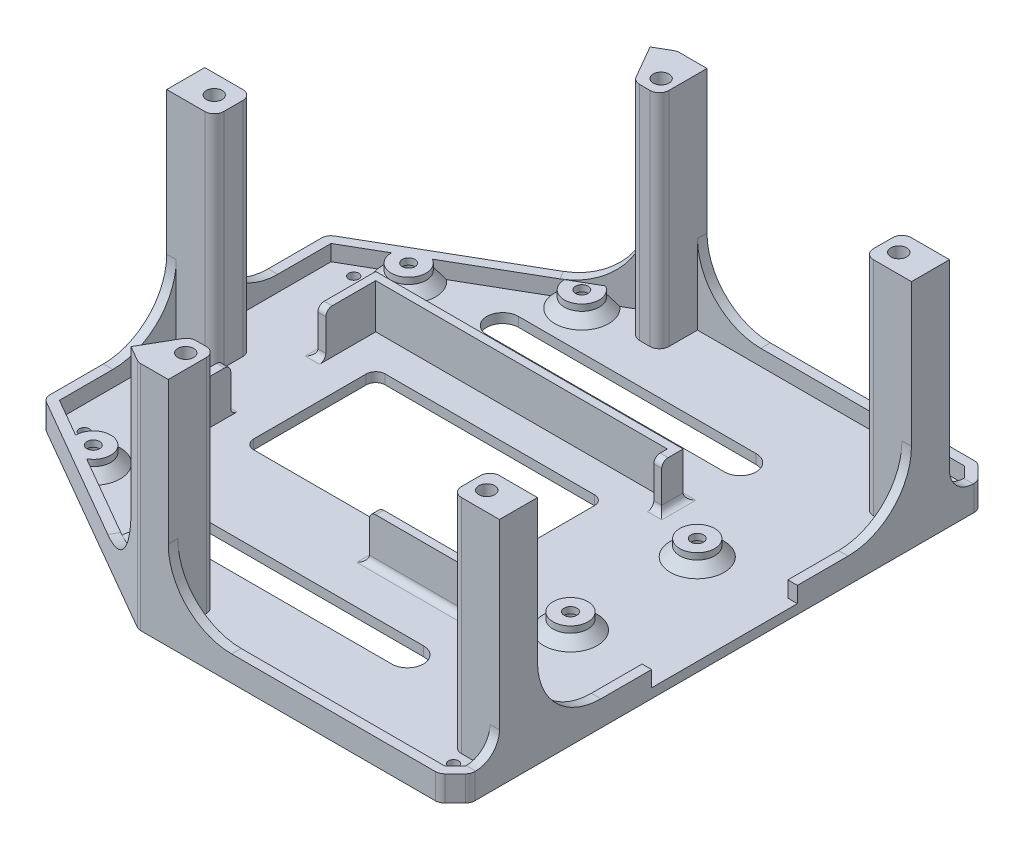
from build123d import *

# Parameters (mm, degrees)
BOSS_EXTRUDE1_DEPTH = 3
CHAMFER1_SIZE       = 5
FILLET1_R           = 3
BOSS_EXTRUDE2_START = 5
BOSS_EXTRUDE2_DEPTH = 5
BOSS_EXTRUDE5_START = 70
SKETCH9_W           = 3
SKETCH9_H           = 12.000000000000007
BOSS_EXTRUDE5_DEPTH = 70
FILLET2_R           = 20
FILLET4_R           = 7.5
SKETCH10_R          = 1.600000000000006
SKETCH10_R_2        = 1.5999999999999994
CUT_EXTRUDE1_DEPTH  = 10
SKETCH11_R          = 2.4999999999999956
SKETCH11_R_2        = 2.5000000000000027
CUT_EXTRUDE2_DEPTH  = 20
SKETCH12_R          = 5.499999999999991
SKETCH12_R_2        = 2.4999999999999956
SKETCH12_R_3        = 5.500000000000005
SKETCH12_R_4        = 2.5000000000000027
BOSS_EXTRUDE6_DEPTH = 3
SKETCH13_R          = 5.5000000000000036
SKETCH13_R_2        = 1.9999999999999991
SKETCH13_R_3        = 1.9999999999999967
BOSS_EXTRUDE7_DEPTH = 2
CHAMFER2_SIZE       = 3
SKETCH14_R          = 2.500000000000009
SKETCH14_R_2        = 2.4999999999999956
SKETCH14_R_3        = 2.5000000000000027
CUT_EXTRUDE3_DEPTH  = 6
SKETCH15_R          = 1.9999999999999967
SKETCH15_R_2        = 2.0000000000000036
CUT_EXTRUDE4_DEPTH  = 20
BOSS_EXTRUDE8_DEPTH = 14
FILLET5_R           = 2
CUT_EXTRUDE5_DEPTH  = 15
CUT_EXTRUDE6_DEPTH  = 15
CUT_EXTRUDE7_DEPTH  = 20


with BuildPart() as part:
    # Sketch1 → Boss-Extrude1 (new body)
    with BuildSketch(Plane(origin=(0, 0, 0), x_dir=(1, 0, 0), z_dir=(0, 1, 0))):
        Polygon((-50, 85), (-120.00000000000003, 44.58548115672608), (-120.00000000000003, -44.58548115672608), (-50, -85), (49.999999999999986, -85), (50, 85), align=None)
    extrude(amount=BOSS_EXTRUDE1_DEPTH)

    # Chamfer1
    chamfer1_edges = [part.edges().sort_by_distance(p)[0] for p in [
        (49.999999999999986, 1.5, 85),
        (50, 1.5, -85),
    ]]
    chamfer(chamfer1_edges, length=CHAMFER1_SIZE)

    # Fillet1
    fillet1_edges = [part.edges().sort_by_distance(p)[0] for p in [
        (-50, 1.5, 85),
        (-120.00000000000003, 1.5, 44.58548115672608),
        (-120.00000000000003, 1.5, -44.58548115672608),
        (-50, 1.5, -85),
        (50, 1.5, -80),
        (49.999999999999986, 1.5, 80),
        (44.999999999999986, 1.5, 85),
        (45, 1.5, -85),
    ]]
    fillet(fillet1_edges, radius=FILLET1_R)

    # Sketch3 → Boss-Extrude2 (add)
    with BuildSketch(Plane(origin=(0, 3, 0), x_dir=(1, 0, 0), z_dir=(0, 1, 0)).offset(BOSS_EXTRUDE2_START)):
        with BuildLine():
            Line((49.999999999999986, -78.7573593128807), (50, 78.75735931288068))
            ThreePointArc((50, 78.75735931288068), (49.77163859753386, 79.90540960997595), (49.121320343559645, 80.87867965644033))
            Line((49.121320343559645, 80.87867965644033), (45.87867965644036, 84.12132034355965))
            ThreePointArc((45.87867965644036, 84.12132034355965), (44.90540960997598, 84.77163859753387), (43.7573593128807, 85))
            Line((43.7573593128807, 85), (-49.19615242270664, 85))
            ThreePointArc((-49.19615242270664, 85), (-49.9726095580142, 84.8977774788672), (-50.69615242270664, 84.59807621135332))
            Line((-50.69615242270664, 84.59807621135332), (-118.50000000000003, 45.45150656051051))
            ThreePointArc((-118.50000000000003, 45.45150656051051), (-119.59807621135333, 44.35343034915719), (-120.00000000000003, 42.8534303491572))
            Line((-120.00000000000003, 42.8534303491572), (-120.00000000000003, -42.85343034915721))
            ThreePointArc((-120.00000000000003, -42.85343034915721), (-119.59807621135334, -44.35343034915721), (-118.50000000000003, -45.45150656051052))
            Line((-118.50000000000003, -45.45150656051052), (-50.69615242270665, -84.59807621135332))
            ThreePointArc((-50.69615242270665, -84.59807621135332), (-49.97260955801421, -84.8977774788672), (-49.19615242270665, -85))
            Line((-49.19615242270665, -85), (43.75735931288061, -85))
            ThreePointArc((43.75735931288061, -85), (44.905409609975884, -84.77163859753387), (45.87867965644027, -84.12132034355966))
            Line((45.87867965644027, -84.12132034355966), (49.121320343559624, -80.87867965644034))
            ThreePointArc((49.121320343559624, -80.87867965644034), (49.771638597533844, -79.90540960997596), (49.999999999999986, -78.7573593128807))
        make_face()
        Polygon((-117.00000000000001, 42.8534303491572), (-117, -42.853430349157215), (-49.19615242270665, -82), (43.75735931288061, -82), (46.999999999999986, -78.7573593128807), (46.999999999999986, 78.7573593128807), (43.75735931288071, 81.99999999999997), (-49.19615242270664, 81.99999999999999), align=None, mode=Mode.SUBTRACT)
    extrude(amount=-BOSS_EXTRUDE2_DEPTH)

    # Sketch9 → Boss-Extrude5 (add)
    with BuildSketch(Plane(origin=(0, 3, 0), x_dir=(1, 0, 0), z_dir=(0, 1, 0)).offset(BOSS_EXTRUDE5_START)):
        with BuildLine():
            Line((-108.00000000000003, 6), (-117.00000000000001, 5.999999999999999))
            Line((-117.00000000000001, 6), (-117.00000000000001, 0))
            Line((-117.00000000000001, 0), (-105.00000000000003, 0))
            Line((-105.00000000000003, 0), (-105.00000000000003, 3.0000000000000004))
            ThreePointArc((-105.00000000000003, 3.0000000000000004), (-105.87867965644038, 5.121320343559644), (-108.00000000000003, 5.999999999999995))
        make_face()
        with BuildLine():
            Line((-105.00000000000003, 0), (-117.00000000000001, 0))
            Line((-117.00000000000001, 0), (-117, -6))
            Line((-117, -5.999999999999999), (-108.00000000000003, -6))
            ThreePointArc((-108.00000000000003, -5.999999999999995), (-105.87867965644038, -5.121320343559644), (-105.00000000000003, -3.0000000000000004))
            Line((-105.00000000000003, -3.0000000000000004), (-105.00000000000003, 0))
        make_face()
        with BuildLine():
            Line((-49.38268590217983, -71.50000000000001), (-53.882685902179844, -79.29422863405998))
            Line((-53.882685902179816, -79.29422863405998), (-49.19615242270666, -82))
            Line((-49.19615242270665, -82), (-40.51666049839536, -82))
            Line((-40.51666049839536, -82), (-40.51666049839537, -73.00000000000001))
            ThreePointArc((-40.51666049839536, -73.00000000000001), (-41.39534015483572, -70.87867965644037), (-43.51666049839537, -70))
            Line((-43.51666049839537, -70), (-46.784609690826514, -69.99999999999999))
            ThreePointArc((-46.784609690826514, -69.99999999999999), (-48.284609690826514, -70.4019237886467), (-49.38268590217983, -71.50000000000001))
        make_face()
        with BuildLine():
            Line((-49.19615242270666, -82), (-53.882685902179816, -79.29422863405998))
            Line((-53.882685902179844, -79.29422863405998), (-55.38268590217983, -81.89230484541326))
            Line((-55.38268590217983, -81.89230484541326), (-50.69615242270666, -84.59807621135332))
            ThreePointArc((-50.69615242270666, -84.59807621135332), (-49.972609558014206, -84.8977774788672), (-49.19615242270663, -85))
            Line((-49.19615242270663, -85), (-40.51666049839536, -85))
            Line((-40.51666049839536, -85), (-40.51666049839536, -82))
            Line((-40.51666049839536, -82), (-49.19615242270665, -82))
        make_face()
        with BuildLine():
            Line((46.999999999999986, -71.00000000000001), (46.999999999999986, -59.000000000000014))
            Line((46.999999999999986, -59.00000000000001), (37.99999999999999, -59.000000000000014))
            ThreePointArc((37.99999999999999, -59.000000000000014), (35.87867965644035, -59.87867965644037), (35, -62.000000000000014))
            Line((34.99999999999999, -62.000000000000014), (34.99999999999999, -68))
            ThreePointArc((35, -68), (35.87867965644034, -70.12132034355966), (37.99999999999999, -71.00000000000001))
            Line((37.99999999999999, -71.00000000000001), (46.999999999999986, -71.00000000000001))
        make_face()
        with Locations((48.499999999999986, -65.00000000000001)):
            Rectangle(SKETCH9_W, SKETCH9_H)
        Polygon((-117.00000000000001, 0), (-117.00000000000001, 6), (-120.00000000000003, 5.999999999999999), (-120.00000000000003, 0), align=None)
        Polygon((-117, -6), (-117.00000000000001, 0), (-120.00000000000003, 0), (-120.00000000000003, -5.999999999999999), align=None)
        with BuildLine():
            Line((-49.19615242270664, 81.99999999999999), (-53.88268590217982, 79.29422863405995))
            Line((-53.88268590217982, 79.29422863405995), (-49.38268590217983, 71.50000000000001))
            ThreePointArc((-49.38268590217983, 71.50000000000001), (-48.284609690826514, 70.4019237886467), (-46.784609690826514, 69.99999999999999))
            Line((-46.784609690826514, 69.99999999999999), (-43.51666049839537, 70))
            ThreePointArc((-43.51666049839537, 70), (-41.39534015483572, 70.87867965644037), (-40.51666049839536, 73.00000000000001))
            Line((-40.51666049839537, 73.00000000000001), (-40.51666049839536, 81.99999999999999))
            Line((-40.51666049839537, 81.99999999999999), (-49.19615242270663, 81.99999999999999))
        make_face()
        with BuildLine():
            Line((-50.69615242270666, 84.59807621135332), (-55.38268590217983, 81.89230484541326))
            Line((-55.38268590217983, 81.89230484541326), (-53.88268590217982, 79.29422863405995))
            Line((-53.88268590217982, 79.29422863405995), (-49.19615242270664, 81.99999999999999))
            Line((-49.19615242270663, 81.99999999999999), (-40.51666049839537, 81.99999999999999))
            Line((-40.51666049839536, 81.99999999999999), (-40.51666049839536, 85))
            Line((-40.51666049839536, 85), (-49.19615242270663, 85))
            ThreePointArc((-49.19615242270663, 85), (-49.972609558014206, 84.8977774788672), (-50.69615242270666, 84.59807621135332))
        make_face()
        with BuildLine():
            Line((46.999999999999986, 59.000000000000014), (46.999999999999986, 71.00000000000001))
            Line((46.999999999999986, 71.00000000000001), (37.99999999999999, 71.00000000000001))
            ThreePointArc((37.99999999999999, 71.00000000000001), (35.87867965644034, 70.12132034355966), (35, 68))
            Line((34.99999999999999, 68), (34.99999999999999, 62.000000000000014))
            ThreePointArc((35, 62.000000000000014), (35.87867965644035, 59.87867965644037), (37.99999999999999, 59.000000000000014))
            Line((37.99999999999999, 59.000000000000014), (46.999999999999986, 59.00000000000001))
        make_face()
        Polygon((49.999999999999986, 59.00000000000001), (49.999999999999986, 71.00000000000001), (46.999999999999986, 71.00000000000001), (46.999999999999986, 59.000000000000014), align=None)
    extrude(amount=-BOSS_EXTRUDE5_DEPTH)

    # Fillet2
    fillet2_edges = [part.edges().sort_by_distance(p)[0] for p in [
        (48.499999999999986, 8, -59.00000000000001),
        (-54.632685902179816, 8, -80.5932667397366),
        (-40.51666049839536, 8, -83.5),
        (-118.50000000000003, 8, -5.999999999999998),
        (-118.50000000000001, 8, 5.999999999999999),
        (48.499999999999986, 8, 59.00000000000001),
        (-54.632685902179844, 8, 80.59326673973662),
        (-40.51666049839536, 8, 83.5),
    ]]
    fillet(fillet2_edges, radius=FILLET2_R)

    # Fillet4
    fillet4_edges = [part.edges().sort_by_distance(p)[0] for p in [
        (48.499999999999986, 8, -71.00000000000001),
        (48.499999999999986, 8, 71.00000000000001),
    ]]
    fillet(fillet4_edges, radius=FILLET4_R)

    # Sketch10 → Cut-Extrude1 (cut)
    with BuildSketch(Plane(origin=(0, 3, 0), x_dir=(1, 0, 0), z_dir=(0, 1, 0))):
        with Locations(Location((-109.49999999999999, 42.499999999999986, 0), (0, 0, 270))):
            Circle(SKETCH10_R)
        with Locations(Location((-109.49999999999997, -42.500000000000014, 0), (0, 0, 270))):
            Circle(SKETCH10_R)
        with Locations(Location((39.5, -75, 0), (0, 0, 270))):
            Circle(SKETCH10_R_2)
        with Locations(Location((39.49999999999997, 75, 0), (0, 0, 270))):
            Circle(SKETCH10_R_2)
    extrude(amount=-CUT_EXTRUDE1_DEPTH, mode=Mode.SUBTRACT)

    # Sketch11 → Cut-Extrude2 (cut)
    with BuildSketch(Plane.XZ):
        with Locations(Location((-99.41050807568905, 49.755752861126005, 0), (0, 0, 270))):
            Circle(SKETCH11_R)
        with Locations(Location((-64.76949192431161, 69.75575286112617, 0), (0, 0, 270))):
            Circle(SKETCH11_R_2)
        with Locations(Location((-99.41050807568908, -49.755752861126034, 0), (0, 0, 270))):
            Circle(SKETCH11_R)
        with Locations(Location((-64.76949192431158, -69.7557528611262, 0), (0, 0, 270))):
            Circle(SKETCH11_R_2)
        with Locations(Location((21.40999999999997, -20.000000000000004, 0), (0, 0, 270))):
            Circle(SKETCH11_R_2)
        with Locations(Location((21.409999999999965, 20.000000000000004, 0), (0, 0, 270))):
            Circle(SKETCH11_R_2)
    extrude(amount=-CUT_EXTRUDE2_DEPTH, mode=Mode.SUBTRACT)

    # Sketch12 → Boss-Extrude6 (add)
    # profile 1 of 6: a face of its own
    with BuildSketch(Plane(origin=(0, 3, 0), x_dir=(1, 0, 0), z_dir=(0, 1, 0))):
        with Locations((-99.41050807568905, -49.755752861126005)):
            Circle(SKETCH12_R)
        with Locations(Location((-99.41050807568905, -49.755752861126005, 0), (0, 0, 90))):
            Circle(SKETCH12_R_2, mode=Mode.SUBTRACT)
    # profile 2 of 6: a face of its own
    with BuildSketch(Plane(origin=(0, 3, 0), x_dir=(1, 0, 0), z_dir=(0, 1, 0))):
        with Locations((-64.76949192431161, -69.75575286112617)):
            Circle(SKETCH12_R_3)
        with Locations(Location((-64.76949192431161, -69.75575286112617, 0), (0, 0, 90))):
            Circle(SKETCH12_R_4, mode=Mode.SUBTRACT)
    # profile 3 of 6: a face of its own
    with BuildSketch(Plane(origin=(0, 3, 0), x_dir=(1, 0, 0), z_dir=(0, 1, 0))):
        with Locations(Location((21.409999999999965, -20.000000000000004, 0), (0, 0, 90))):
            Circle(SKETCH12_R_3)
        with Locations(Location((21.409999999999965, -20.000000000000004, 0), (0, 0, 90))):
            Circle(SKETCH12_R_4, mode=Mode.SUBTRACT)
    # profile 4 of 6: a face of its own
    with BuildSketch(Plane(origin=(0, 3, 0), x_dir=(1, 0, 0), z_dir=(0, 1, 0))):
        with Locations(Location((21.40999999999997, 20.000000000000004, 0), (0, 0, 90))):
            Circle(SKETCH12_R_3)
        with Locations(Location((21.40999999999997, 20.000000000000004, 0), (0, 0, 90))):
            Circle(SKETCH12_R_4, mode=Mode.SUBTRACT)
    # profile 5 of 6: a face of its own
    with BuildSketch(Plane(origin=(0, 3, 0), x_dir=(1, 0, 0), z_dir=(0, 1, 0))):
        with Locations((-64.76949192431158, 69.7557528611262)):
            Circle(SKETCH12_R_3)
        with Locations(Location((-64.76949192431158, 69.7557528611262, 0), (0, 0, 90))):
            Circle(SKETCH12_R_4, mode=Mode.SUBTRACT)
    # profile 6 of 6: a face of its own
    with BuildSketch(Plane(origin=(0, 3, 0), x_dir=(1, 0, 0), z_dir=(0, 1, 0))):
        with Locations((-99.41050807568908, 49.755752861126034)):
            Circle(SKETCH12_R)
        with Locations(Location((-99.41050807568908, 49.755752861126034, 0), (0, 0, 90))):
            Circle(SKETCH12_R_2, mode=Mode.SUBTRACT)
    extrude(amount=BOSS_EXTRUDE6_DEPTH)

    # Sketch13 → Boss-Extrude7 (add)
    # profile 1 of 6: a face of its own
    with BuildSketch(Plane(origin=(0, 6, 0), x_dir=(1, 0, 0), z_dir=(0, 1, 0))):
        with Locations(Location((21.409999999999965, -20.000000000000004, 0), (0, 0, 90))):
            Circle(SKETCH13_R)
        with Locations(Location((21.409999999999965, -20.000000000000004, 0), (0, 0, 270))):
            Circle(SKETCH13_R_2, mode=Mode.SUBTRACT)
    # profile 2 of 6: a face of its own
    with BuildSketch(Plane(origin=(0, 6, 0), x_dir=(1, 0, 0), z_dir=(0, 1, 0))):
        with Locations(Location((21.40999999999997, 20.000000000000004, 0), (0, 0, 90))):
            Circle(SKETCH13_R)
        with Locations(Location((21.40999999999997, 20.000000000000004, 0), (0, 0, 270))):
            Circle(SKETCH13_R_2, mode=Mode.SUBTRACT)
    # profile 3 of 6: a face of its own
    with BuildSketch(Plane(origin=(0, 6, 0), x_dir=(1, 0, 0), z_dir=(0, 1, 0))):
        with BuildLine():
            Line((-70.268940688069, -69.83362002241704), (-62.087202482231405, -74.55734877799642))
            ThreePointArc((-62.087202482231405, -74.55734877799642), (-62.0194919243116, -64.99261314031176), (-70.268940688069, -69.83362002241704))
        make_face()
        with Locations(Location((-64.76949192431161, -69.75575286112617, 0), (0, 0, 270))):
            Circle(SKETCH13_R_3, mode=Mode.SUBTRACT)
    # profile 4 of 6: a face of its own
    with BuildSketch(Plane(origin=(0, 6, 0), x_dir=(1, 0, 0), z_dir=(0, 1, 0))):
        with BuildLine():
            Line((-62.08720248223135, 74.55734877799644), (-70.26894068806897, 69.83362002241702))
            ThreePointArc((-70.26894068806897, 69.83362002241702), (-62.01949192431156, 64.99261314031179), (-62.08720248223135, 74.55734877799644))
        make_face()
        with Locations(Location((-64.76949192431158, 69.7557528611262, 0), (0, 0, 270))):
            Circle(SKETCH13_R_3, mode=Mode.SUBTRACT)
    # profile 5 of 6: a face of its own
    with BuildSketch(Plane(origin=(0, 6, 0), x_dir=(1, 0, 0), z_dir=(0, 1, 0))):
        with BuildLine():
            Line((-96.72821863360899, 54.55734877799633), (-104.90995683944644, 49.83362002241702))
            ThreePointArc((-104.90995683944644, 49.83362002241702), (-96.66050807568908, 44.99261314031163), (-96.72821863360899, 54.55734877799633))
        make_face()
        with Locations(Location((-99.41050807568908, 49.755752861126034, 0), (0, 0, 270))):
            Circle(SKETCH13_R_3, mode=Mode.SUBTRACT)
    # profile 6 of 6: a face of its own
    with BuildSketch(Plane(origin=(0, 6, 0), x_dir=(1, 0, 0), z_dir=(0, 1, 0))):
        with BuildLine():
            Line((-104.90995683944641, -49.83362002241705), (-96.728218633609, -54.55734877799634))
            ThreePointArc((-96.728218633609, -54.55734877799634), (-96.66050807568905, -44.9926131403116), (-104.90995683944641, -49.83362002241705))
        make_face()
        with Locations(Location((-99.41050807568905, -49.755752861126005, 0), (0, 0, 270))):
            Circle(SKETCH13_R_3, mode=Mode.SUBTRACT)
    extrude(amount=BOSS_EXTRUDE7_DEPTH)

    # Chamfer2
    chamfer2_edges = [part.edges().sort_by_distance(p)[0] for p in [
        (21.409999999999965, 3, 25.500000000000007),
        (21.40999999999997, 3, -14.499999999999998),
        (-96.66050807568912, 3, -44.99261314031161),
        (-62.01949192431161, 3, -64.99261314031176),
        (-62.019491924311694, 3, 64.9926131403117),
        (-96.66050807568915, 3, 44.99261314031155),
    ]]
    chamfer(chamfer2_edges, length=CHAMFER2_SIZE)

    # Sketch14 → Cut-Extrude3 (cut)
    with BuildSketch(Plane(origin=(0, 73.00000000000001, 0), x_dir=(1, 0, 0), z_dir=(0, 1, 0))):
        with Locations(Location((-111, 0, 0), (0, 0, 270))):
            Circle(SKETCH14_R)
        with Locations(Location((-45.00000000000002, 75, 0), (0, 0, 270))):
            Circle(SKETCH14_R_2)
        with Locations(Location((40.00000000000001, 65, 0), (0, 0, 270))):
            Circle(SKETCH14_R_3)
        with Locations(Location((40.00000000000001, -65, 0), (0, 0, 270))):
            Circle(SKETCH14_R_3)
        with Locations(Location((-45.000000000000014, -74.99999999999996, 0), (0, 0, 270))):
            Circle(SKETCH14_R_3)
    extrude(amount=-CUT_EXTRUDE3_DEPTH, mode=Mode.SUBTRACT)

    # Sketch15 → Cut-Extrude4 (cut)
    with BuildSketch(Plane(origin=(0, 67, 0), x_dir=(1, 0, 0), z_dir=(0, 1, 0))):
        with Locations(Location((-111, 0, 0), (0, 0, 270))):
            Circle(SKETCH15_R)
        with Locations(Location((-45.00000000000002, 75, 0), (0, 0, 270))):
            Circle(SKETCH15_R_2)
        with Locations(Location((40.00000000000001, 65, 0), (0, 0, 270))):
            Circle(SKETCH15_R_2)
        with Locations(Location((40.00000000000001, -65, 0), (0, 0, 270))):
            Circle(SKETCH15_R_2)
        with Locations(Location((-45.000000000000014, -74.99999999999996, 0), (0, 0, 270))):
            Circle(SKETCH15_R_2)
    extrude(amount=-CUT_EXTRUDE4_DEPTH, mode=Mode.SUBTRACT)

    # Sketch16 → Boss-Extrude8 (add)
    with BuildSketch(Plane(origin=(0, 3, 0), x_dir=(1, 0, 0), z_dir=(0, 1, 0))):
        Polygon((-93.29500000000002, 15.000000000000004), (-90.79500000000002, 15.000000000000004), (-90.79500000000002, 30.75), (1.204999999999984, 30.75), (1.2049999999999788, 26.5), (3.7049999999999783, 26.5), (3.7049999999999788, 33.25), (-93.29500000000002, 33.25), align=None)
        Polygon((-83.79500000000002, -30.75), (-90.79500000000002, -30.75), (-90.79500000000002, -15), (-93.29500000000002, -15), (-93.29500000000002, -33.25), (-83.79500000000002, -33.25), align=None)
        Polygon((1.204999999999984, -30.75), (-28.795000000000016, -30.75), (-28.795000000000016, -33.25), (3.70499999999997, -33.25), (3.704999999999973, -26.5), (1.2049999999999792, -26.5), align=None)
    extrude(amount=BOSS_EXTRUDE8_DEPTH)

    # Fillet5
    fillet5_edges = [part.edges().sort_by_distance(p)[0] for p in [
        (-92.04500000000002, 17, -15.000000000000004),
        (2.4549999999999788, 3, -26.5),
        (3.7049999999999783, 3, -29.875),
        (2.4549999999999788, 17, -26.5),
        (-92.04500000000002, 3, -15.000000000000004),
        (-93.29500000000002, 3, -24.125),
        (-44.795000000000016, 3, -33.25),
        (-92.04500000000002, 3, 15),
        (-88.54500000000002, 3, 33.25),
        (-83.79500000000002, 17, 32),
        (-92.04500000000002, 17, 15),
        (-83.79500000000002, 3, 32),
        (-93.29500000000002, 3, 24.125),
        (-28.795000000000016, 3, 32),
        (-12.545000000000023, 3, 33.25),
        (3.7049999999999725, 3, 29.875),
        (2.4549999999999788, 17, 26.5),
        (-28.795000000000016, 17, 32),
        (2.4549999999999788, 3, 26.5),
    ]]
    fillet(fillet5_edges, radius=FILLET5_R)

    # Sketch17 → Cut-Extrude5 (cut)
    with BuildSketch(Plane(origin=(0, 3, 0), x_dir=(1, 0, 0), z_dir=(0, 1, 0))):
        with BuildLine():
            Line((-11.795000000000032, -20.749999999999996), (-77.795, -20.749999999999996))
            ThreePointArc((-77.795, -20.749999999999996), (-79.91632034355966, -19.87132034355964), (-80.79500000000002, -17.74999999999998))
            Line((-80.79500000000002, -17.74999999999998), (-80.79500000000002, 17.74999999999998))
            ThreePointArc((-80.79500000000002, 17.74999999999998), (-79.91632034355966, 19.87132034355964), (-77.795, 20.749999999999996))
            Line((-77.795, 20.749999999999996), (-11.795000000000032, 20.749999999999996))
            ThreePointArc((-11.795000000000032, 20.749999999999996), (-9.673679656440367, 19.871320343559642), (-8.795000000000009, 17.74999999999998))
            Line((-8.795000000000009, 17.74999999999998), (-8.795000000000009, -17.74999999999998))
            ThreePointArc((-8.795000000000009, -17.74999999999998), (-9.67367965644037, -19.87132034355964), (-11.795000000000032, -20.749999999999996))
        make_face()
    extrude(amount=-CUT_EXTRUDE5_DEPTH, mode=Mode.SUBTRACT)

    # Sketch18 → Cut-Extrude6 (cut)
    with BuildSketch(Plane(origin=(0, 3, 0), x_dir=(1, 0, 0), z_dir=(0, 1, 0))):
        with BuildLine():
            Line((-72.50000000000001, 57.49999999999999), (2.4999999999999742, 57.49999999999999))
            ThreePointArc((2.4999999999999742, 57.49999999999999), (7.4999999999999885, 52.5), (2.4999999999999742, 47.49999999999999))
            Line((2.4999999999999742, 47.49999999999999), (-72.50000000000001, 47.49999999999999))
            ThreePointArc((-72.50000000000001, 47.49999999999999), (-77.5, 52.5), (-72.50000000000001, 57.49999999999999))
        make_face()
        with BuildLine():
            Line((-72.50000000000001, -47.5), (2.4999999999999742, -47.5))
            ThreePointArc((2.4999999999999742, -47.5), (7.499999999999967, -52.5), (2.4999999999999742, -57.49999999999999))
            Line((2.4999999999999742, -57.49999999999999), (-72.50000000000001, -57.49999999999999))
            ThreePointArc((-72.50000000000001, -57.49999999999999), (-77.50000000000001, -52.5), (-72.50000000000001, -47.5))
        make_face()
    extrude(amount=-CUT_EXTRUDE6_DEPTH, mode=Mode.SUBTRACT)

    # Sketch19 → Cut-Extrude7 (cut)
    with BuildSketch(Plane(origin=(0, 3, 0), x_dir=(1, 0, 0), z_dir=(0, 1, 0))):
        Polygon((41.999999999999986, -23.000000000000007), (51.999999999999986, -23.000000000000004), (51.999999999999986, 22.999999999999986), (41.99999999999998, 22.999999999999993), align=None)
    extrude(amount=CUT_EXTRUDE7_DEPTH, mode=Mode.SUBTRACT)


solid = part.part
